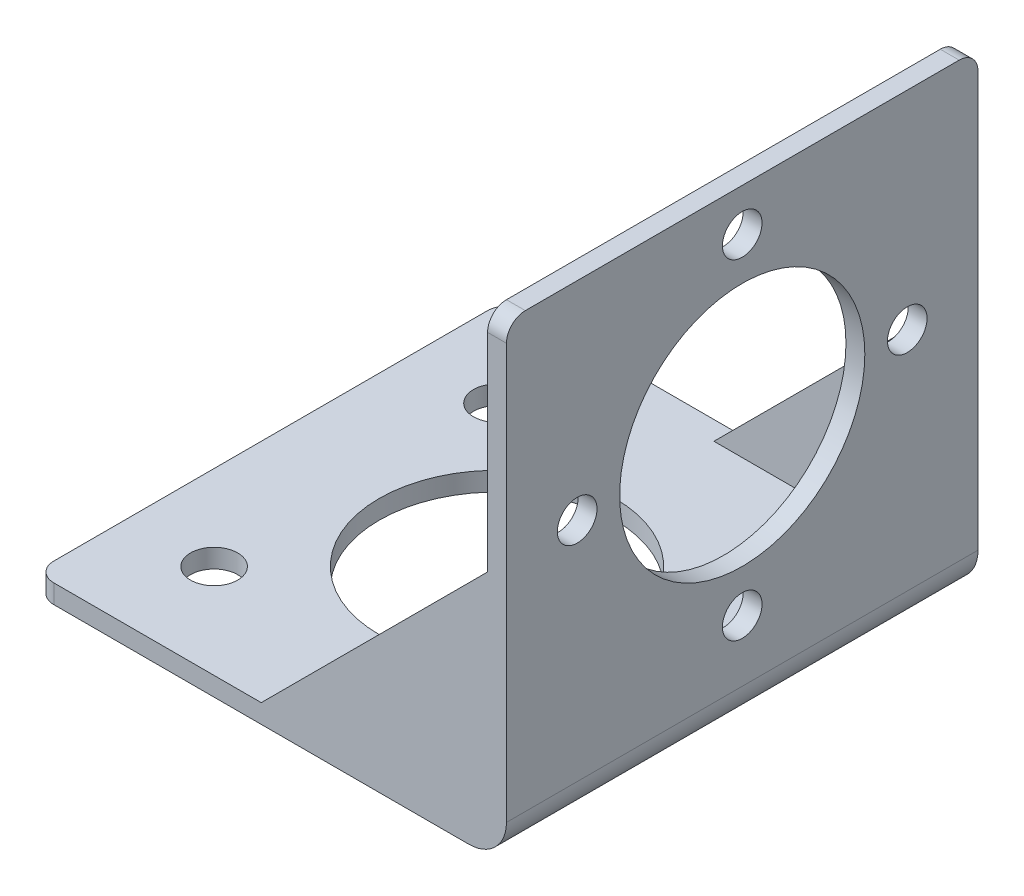
from build123d import *

# Parameters (mm, degrees)
EXTRUDE_1_DEPTH     = 50
SKETCH_2_R          = 13
SKETCH_2_R_2        = 2.1
CUT_EXTRUDE_1_DEPTH = 50
FILLET_1_R          = 2
SKETCH_4_R          = 12.5
SKETCH_4_R_2        = 2.5
CUT_EXTRUDE_2_DEPTH = 50
EXTRUDE_2_DEPTH     = 2
EXTRUDE_START       = -50
EXTRUDE_3_DEPTH     = 2


with BuildPart() as part:
    # 草图1 → 凸台-拉伸1 (new body)
    with BuildSketch(Plane.XY):
        with BuildLine():
            Line((0, 0), (46, 0))
            ThreePointArc((46, 0), (48.828427125, 1.171572875), (50, 4))
            Line((50, 4), (50, 50))
            Line((50, 50), (48, 50))
            Line((48, 50), (48, 4))
            ThreePointArc((48, 4), (47.414213562, 2.585786438), (46, 2))
            Line((46, 2), (0, 2))
            Line((0, 2), (0, 0))
        make_face()
    extrude(amount=EXTRUDE_1_DEPTH)

    # 草图2 → 切除-拉伸1 (cut)
    with BuildSketch(Plane(origin=(50, 0, 0), x_dir=(0, 0, -1), z_dir=(1, 0, 0))):
        with Locations((-25, 28)):
            Circle(SKETCH_2_R)
        with Locations((-25, 45.5)):
            Circle(SKETCH_2_R_2)
        with Locations((-7.5, 28)):
            Circle(SKETCH_2_R_2)
        with Locations((-25, 10.5)):
            Circle(SKETCH_2_R_2)
        with Locations((-42.5, 28)):
            Circle(SKETCH_2_R_2)
    extrude(amount=-CUT_EXTRUDE_1_DEPTH, mode=Mode.SUBTRACT)

    # 圆角1
    fillet_1_edges = [part.edges().sort_by_distance(p)[0] for p in [
        (0, 1, 0),
        (49, 50, 50),
        (0, 1, 50),
        (49, 50, 0),
    ]]
    fillet(fillet_1_edges, radius=FILLET_1_R)

    # 草图4 → 切除-拉伸2 (cut)
    with BuildSketch(Plane.XZ):
        with Locations((24, 25)):
            Circle(SKETCH_4_R)
        with Locations((39, 10)):
            Circle(SKETCH_4_R_2)
        with Locations((9, 10)):
            Circle(SKETCH_4_R_2)
        with Locations((9, 40)):
            Circle(SKETCH_4_R_2)
        with Locations((39, 40)):
            Circle(SKETCH_4_R_2)
    extrude(amount=-CUT_EXTRUDE_2_DEPTH, mode=Mode.SUBTRACT)

    # 草图5 → 凸台-拉伸2 (add)
    with BuildSketch(Plane(origin=(0, 0, 0), x_dir=(-1, 0, 0), z_dir=(0, 0, -1))):
        Polygon((-48, 26), (-24, 2), (-48.828427125, 1.171572875), align=None)
    extrude(amount=-EXTRUDE_2_DEPTH)

    # 草图5<2> → 凸台-拉伸3 (add)
    with BuildSketch(Plane(origin=(0, 0, 0), x_dir=(-1, 0, 0), z_dir=(0, 0, -1)).offset(EXTRUDE_START)):
        Polygon((-48, 26), (-24, 2), (-48.828427125, 1.171572875), align=None)
    extrude(amount=EXTRUDE_3_DEPTH)


solid = part.part
